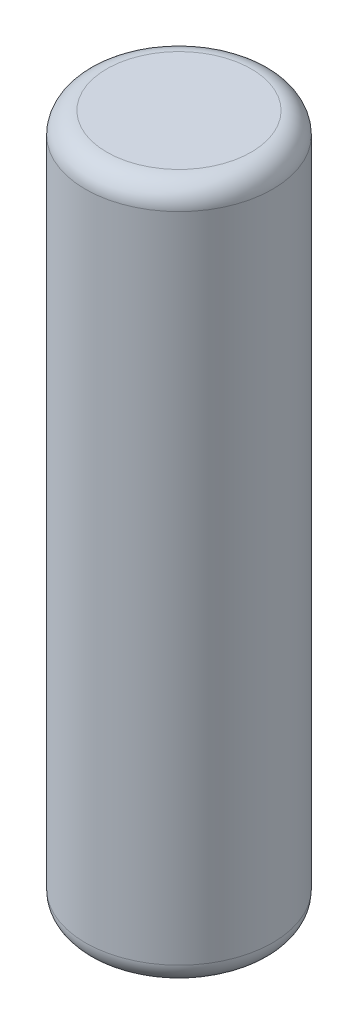
from build123d import *

# Parameters (mm, degrees)
SKETCH1_R           = 8.89
BOSS_EXTRUDE1_DEPTH = 66.04
FILLET1_R           = 2.032


with BuildPart() as part:
    # Sketch1 → Boss-Extrude1 (new body)
    with BuildSketch(Plane(origin=(0, 0, 0), x_dir=(1, 0, 0), z_dir=(0, 1, 0))):
        with Locations(Location((0, 0, 0), (0, 0, 270))):
            Circle(SKETCH1_R)
    extrude(amount=BOSS_EXTRUDE1_DEPTH)

    # Fillet1
    fillet1_edges = [part.edges().sort_by_distance(p)[0] for p in [
        (0, 0, -8.89),
        (0, 66.04, -8.89),
    ]]
    fillet(fillet1_edges, radius=FILLET1_R)


solid = part.part
